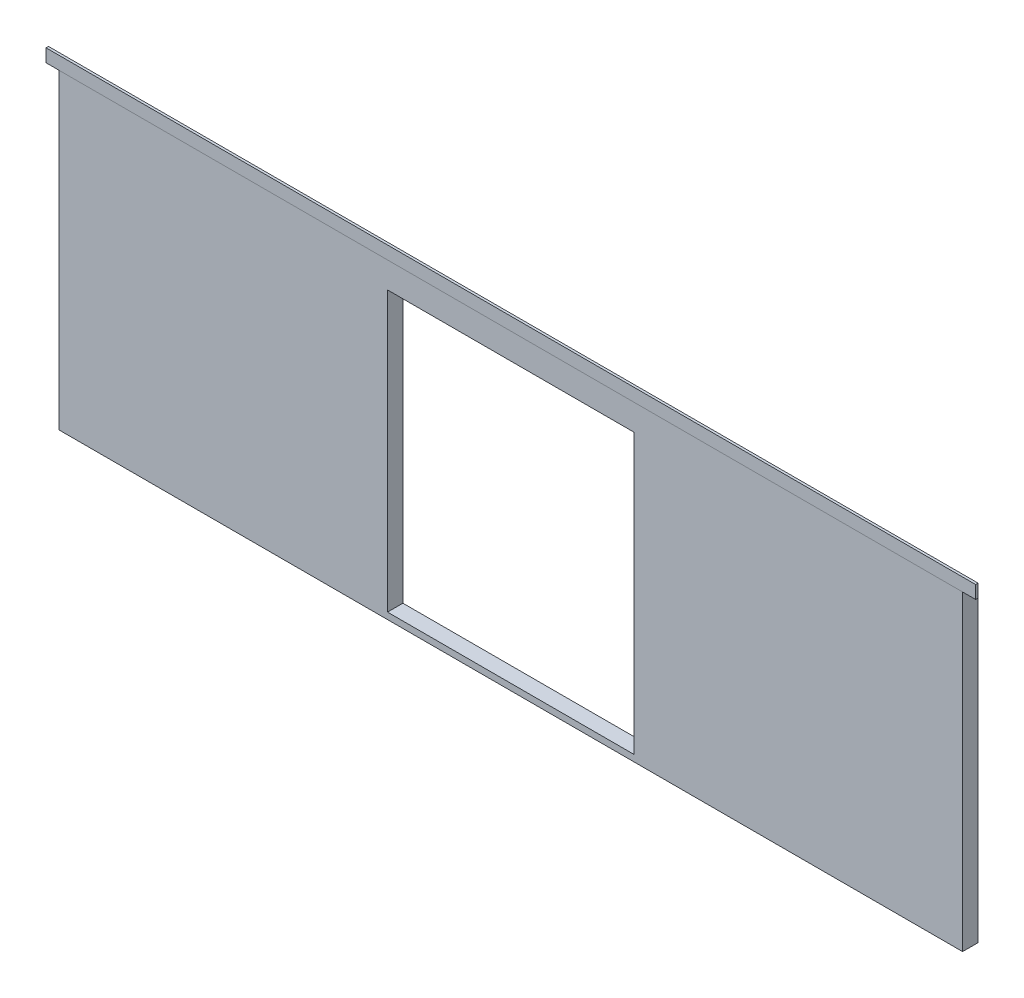
from build123d import *

# Parameters (mm, degrees)
SKETCH1_W           = 355.6
SKETCH1_H           = 2336.8
SKETCH1_W_2         = 282.575
BOSS_EXTRUDE1_DEPTH = 101.6
SKETCH2_W           = 7073.9
SKETCH2_H           = 2438.4
BOSS_EXTRUDE2_DEPTH = 19.05
CUT_EXTRUDE1_DEPTH  = 4298.71640351
SKETCH4_W           = 355.6
SKETCH4_H           = 101.6
BOSS_EXTRUDE3_DEPTH = 101.6
BOSS_EXTRUDE5_DEPTH = 19.05


with BuildPart() as part:
    # Sketch1 → Boss-Extrude1 (new body)
    with BuildSketch(Plane.XY):
        Polygon((0, 0), (3536.95, 0), (3536.95, 2438.4), (-3536.95, 2438.4), (-3536.95, 0), align=None)
        with Locations((203.2, 1219.2)):
            Rectangle(SKETCH1_W, SKETCH1_H, mode=Mode.SUBTRACT)
        with Locations((-203.2, 1219.2)):
            Rectangle(SKETCH1_W, SKETCH1_H, mode=Mode.SUBTRACT)
        with Locations((609.6, 1219.2)):
            Rectangle(SKETCH1_W, SKETCH1_H, mode=Mode.SUBTRACT)
        with Locations((1016, 1219.2)):
            Rectangle(SKETCH1_W, SKETCH1_H, mode=Mode.SUBTRACT)
        with Locations((-3344.8625, 1219.2)):
            Rectangle(SKETCH1_W_2, SKETCH1_H, mode=Mode.SUBTRACT)
        with Locations((3344.8625, 1219.2)):
            Rectangle(SKETCH1_W_2, SKETCH1_H, mode=Mode.SUBTRACT)
        with Locations((1422.4, 1219.2)):
            Rectangle(SKETCH1_W, SKETCH1_H, mode=Mode.SUBTRACT)
        with Locations((1828.8, 1219.2)):
            Rectangle(SKETCH1_W, SKETCH1_H, mode=Mode.SUBTRACT)
        with Locations((2235.2, 1219.2)):
            Rectangle(SKETCH1_W, SKETCH1_H, mode=Mode.SUBTRACT)
        with Locations((2641.6, 1219.2)):
            Rectangle(SKETCH1_W, SKETCH1_H, mode=Mode.SUBTRACT)
        with Locations((3011.4875, 1219.2)):
            Rectangle(SKETCH1_W_2, SKETCH1_H, mode=Mode.SUBTRACT)
        with Locations((-609.6, 1219.2)):
            Rectangle(SKETCH1_W, SKETCH1_H, mode=Mode.SUBTRACT)
        with Locations((-1016, 1219.2)):
            Rectangle(SKETCH1_W, SKETCH1_H, mode=Mode.SUBTRACT)
        with Locations((-1422.4, 1219.2)):
            Rectangle(SKETCH1_W, SKETCH1_H, mode=Mode.SUBTRACT)
        with Locations((-1828.8, 1219.2)):
            Rectangle(SKETCH1_W, SKETCH1_H, mode=Mode.SUBTRACT)
        with Locations((-2235.2, 1219.2)):
            Rectangle(SKETCH1_W, SKETCH1_H, mode=Mode.SUBTRACT)
        with Locations((-2641.6, 1219.2)):
            Rectangle(SKETCH1_W, SKETCH1_H, mode=Mode.SUBTRACT)
        with Locations((-3011.4875, 1219.2)):
            Rectangle(SKETCH1_W_2, SKETCH1_H, mode=Mode.SUBTRACT)
    extrude(amount=BOSS_EXTRUDE1_DEPTH)

    # Sketch2 → Boss-Extrude2 (add)
    with BuildSketch(Plane.XY.offset(101.6)):
        with Locations((0, 1219.2)):
            Rectangle(SKETCH2_W, SKETCH2_H)
    extrude(amount=BOSS_EXTRUDE2_DEPTH)

    # Sketch3 → Cut-Extrude1 (cut, through all)
    with BuildSketch(Plane.XY.offset(120.65)):
        Polygon((0, 2235.2), (965.2, 2235.2), (965.2, 50.8), (-965.2, 50.8), (-965.2, 2235.2), align=None)
    extrude(amount=-CUT_EXTRUDE1_DEPTH, mode=Mode.SUBTRACT)

    # Sketch4 → Boss-Extrude3 (add)
    with BuildSketch(Plane(origin=(0, 0, 101.6), x_dir=(-1, 0, 0), z_dir=(0, 0, -1))):
        Polygon((-965.2, 2336.8), (-965.2, 2387.6), (-1066.8, 2387.6), (-1066.8, 50.8), (-965.2, 50.8), (-965.2, 2235.2), (-838.2, 2235.2), (-838.2, 2336.8), align=None)
        Polygon((965.2, 2336.8), (965.2, 2387.6), (1066.8, 2387.6), (1066.8, 50.8), (965.2, 50.8), (965.2, 2235.2), (838.2, 2235.2), (838.2, 2336.8), align=None)
        with Locations((-609.6, 2286)):
            Rectangle(SKETCH4_W, SKETCH4_H)
        with Locations((-203.2, 2286)):
            Rectangle(SKETCH4_W, SKETCH4_H)
        with Locations((203.2, 2286)):
            Rectangle(SKETCH4_W, SKETCH4_H)
        with Locations((609.6, 2286)):
            Rectangle(SKETCH4_W, SKETCH4_H)
    extrude(amount=BOSS_EXTRUDE3_DEPTH)


with BuildPart() as body_2:
    # Sketch5 → Boss-Extrude5 (new body)
    with BuildSketch(Plane.XY.offset(120.65)):
        Polygon((-3536.95, 2438.4), (-3638.55, 2438.4), (-3638.55, 2540), (3638.55, 2540), (3638.55, 2438.4), (3536.95, 2438.4), align=None)
    extrude(amount=-BOSS_EXTRUDE5_DEPTH)


solid = Compound([part.part, body_2.part])
